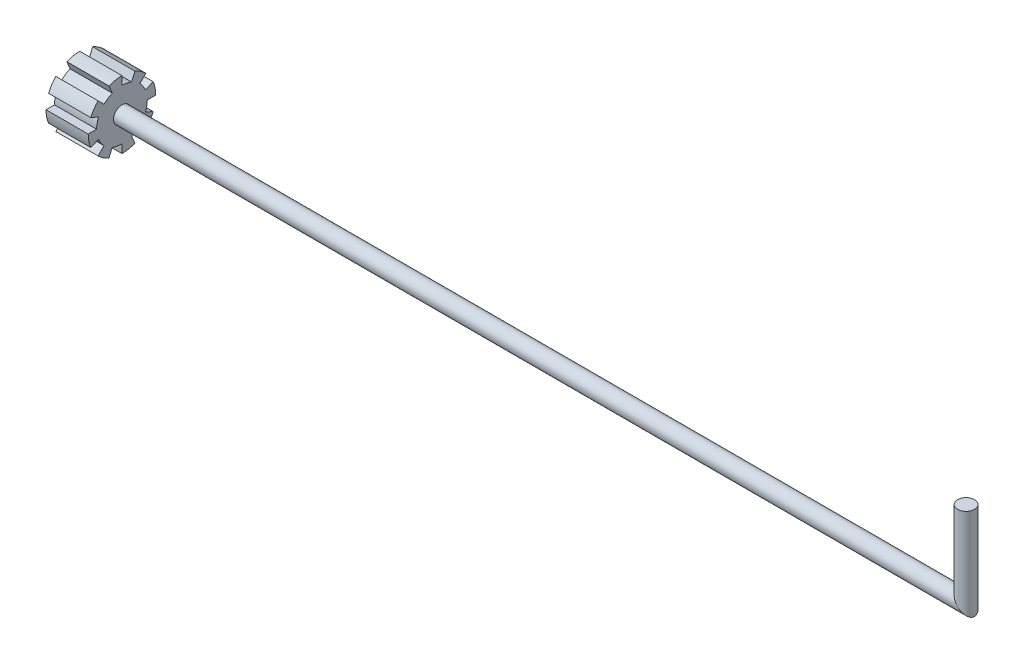
from build123d import *

# Parameters (mm, degrees)
IZIM1_R                     = 4
Y_KSEKLIK_EKSTR_ZYON1_DEPTH = 5
KES_EKSTR_ZYON1_DEPTH       = 5
IZIM3_R                     = 1


with BuildPart() as part:
    # Çizim1 → Yükseklik-Ekstrüzyon1 (new body)
    with BuildSketch(Plane(origin=(0, 0, 0), x_dir=(0, 0, -1), z_dir=(1, 0, 0))):
        Circle(IZIM1_R)
    extrude(amount=Y_KSEKLIK_EKSTR_ZYON1_DEPTH)

    # Çizim2 → Kes-Ekstrüzyon1 (cut)
    with BuildSketch(Plane(origin=(0, 0, 0), x_dir=(0, 0, -1), z_dir=(1, 0, 0))):
        with BuildLine():
            Line((0, 3), (0, 4))
            ThreePointArc((0, 4), (0.780361288, 3.923141122), (1.530733729, 3.69551813))
            Line((1.530733729, 3.69551813), (1.148050297, 2.771638598))
            ThreePointArc((1.148050297, 2.771638598), (0.585270966, 2.942355841), (0, 3))
        make_face()
        with BuildLine():
            Line((2.121320344, 2.121320344), (2.828427125, 2.828427125))
            ThreePointArc((2.828427125, 2.828427125), (3.325878449, 2.222280932), (3.69551813, 1.530733729))
            Line((3.69551813, 1.530733729), (2.771638598, 1.148050297))
            ThreePointArc((2.771638598, 1.148050297), (2.494408837, 1.666710699), (2.121320344, 2.121320344))
        make_face()
        with BuildLine():
            Line((3, 0), (4, 0))
            ThreePointArc((4, 0), (3.923141122, -0.780361288), (3.69551813, -1.530733729))
            Line((3.69551813, -1.530733729), (2.771638598, -1.148050297))
            ThreePointArc((2.771638598, -1.148050297), (2.942355841, -0.585270966), (3, 0))
        make_face()
        with BuildLine():
            Line((2.121320344, -2.121320344), (2.828427125, -2.828427125))
            ThreePointArc((2.828427125, -2.828427125), (2.222280932, -3.325878449), (1.530733729, -3.69551813))
            Line((1.530733729, -3.69551813), (1.148050297, -2.771638598))
            ThreePointArc((1.148050297, -2.771638598), (1.666710699, -2.494408837), (2.121320344, -2.121320344))
        make_face()
        with BuildLine():
            Line((0, -3), (0, -4))
            ThreePointArc((0, -4), (-0.780361288, -3.923141122), (-1.530733729, -3.69551813))
            Line((-1.530733729, -3.69551813), (-1.148050297, -2.771638598))
            ThreePointArc((-1.148050297, -2.771638598), (-0.585270966, -2.942355841), (0, -3))
        make_face()
        with BuildLine():
            Line((-2.121320344, -2.121320344), (-2.828427125, -2.828427125))
            ThreePointArc((-2.828427125, -2.828427125), (-3.325878449, -2.222280932), (-3.69551813, -1.530733729))
            Line((-3.69551813, -1.530733729), (-2.771638598, -1.148050297))
            ThreePointArc((-2.771638598, -1.148050297), (-2.494408837, -1.666710699), (-2.121320344, -2.121320344))
        make_face()
        with BuildLine():
            Line((-3, 0), (-4, 0))
            ThreePointArc((-4, 0), (-3.923141122, 0.780361288), (-3.69551813, 1.530733729))
            Line((-3.69551813, 1.530733729), (-2.771638598, 1.148050297))
            ThreePointArc((-2.771638598, 1.148050297), (-2.942355841, 0.585270966), (-3, 0))
        make_face()
        with BuildLine():
            Line((-2.121320344, 2.121320344), (-2.828427125, 2.828427125))
            ThreePointArc((-2.828427125, 2.828427125), (-2.222280932, 3.325878449), (-1.530733729, 3.69551813))
            Line((-1.530733729, 3.69551813), (-1.148050297, 2.771638598))
            ThreePointArc((-1.148050297, 2.771638598), (-1.666710699, 2.494408837), (-2.121320344, 2.121320344))
        make_face()
    extrude(amount=KES_EKSTR_ZYON1_DEPTH, mode=Mode.SUBTRACT)

    # Süpür1: sweep along a path in Çizim4
    with BuildLine(Plane.XY) as s_p_r1_path:
        Line((5, 0), (105, 0))
        Line((105, 0), (105, 10))
    # Çizim3 → Süpür1 (sweep)
    with BuildSketch(Plane(origin=(5, 0, 0), x_dir=(0, 0, -1), z_dir=(1, 0, 0))):
        Circle(IZIM3_R)
    sweep(path=s_p_r1_path.line, transition=Transition.RIGHT)


solid = part.part
